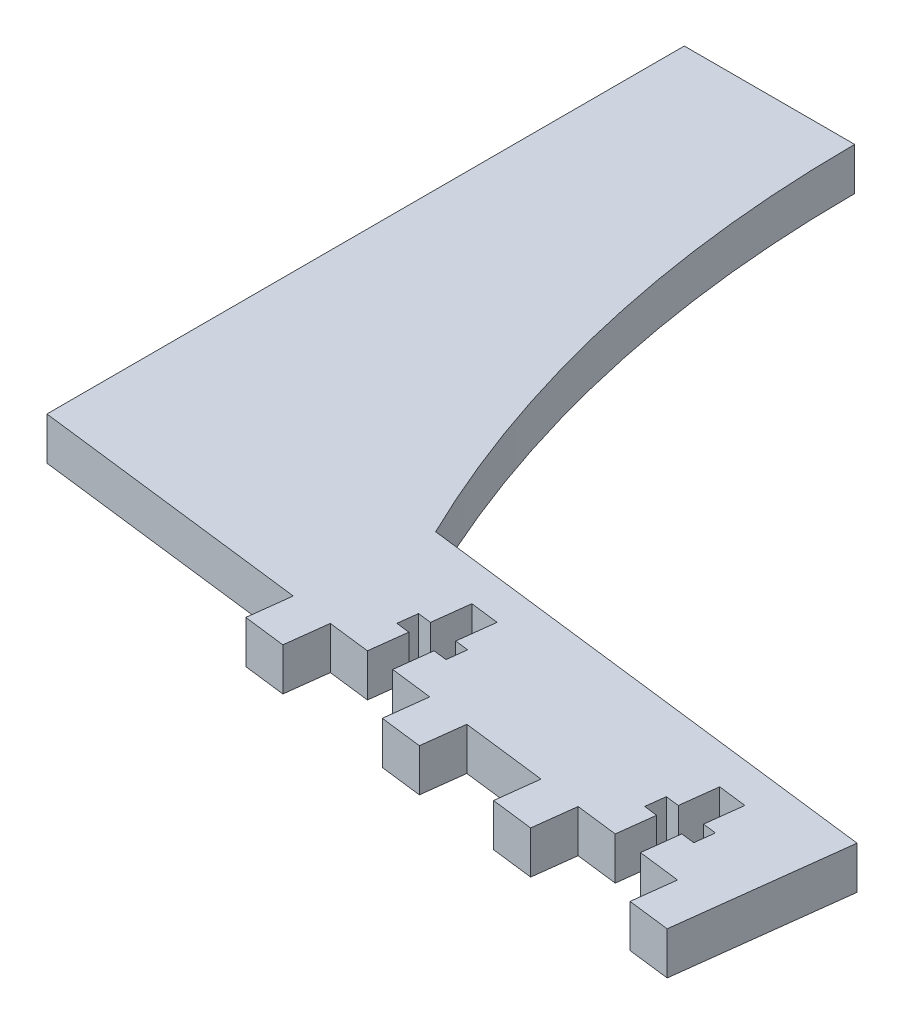
from build123d import *

# Parameters (mm, degrees)
BOSS_EXTRUDE1_DEPTH = 6.35


with BuildPart() as part:
    # Sketch1 → Boss-Extrude1 (new body)
    with BuildSketch(Plane(origin=(0, 0, 0), x_dir=(1, 0, 0), z_dir=(0, 1, 0))):
        with BuildLine():
            Line((71.346202472, -8.760212143), (83.951538598, -10.307952804))
            Line((83.951538598, -10.307952804), (83.177668268, -16.610620867))
            Line((83.177668268, -16.610620867), (89.48033633, -17.384491197))
            Line((89.48033633, -17.384491197), (90.254206661, -11.081823135))
            Line((90.254206661, -11.081823135), (96.556874724, -11.855693465))
            Line((96.556874724, -11.855693465), (97.231421537, -6.361950537))
            Line((97.231421537, -6.361950537), (95.20563486, -6.113215209))
            Line((95.20563486, -6.113215209), (95.559055961, -3.234831328))
            Line((95.559055961, -3.234831328), (97.584842638, -3.483566655))
            Line((97.584842638, -3.483566655), (98.259389451, 2.010176273))
            Line((98.259389451, 2.010176273), (102.545203734, 1.483944448))
            Line((102.545203734, 1.483944448), (101.870656921, -4.00979848))
            Line((101.870656921, -4.00979848), (103.896443599, -4.258533808))
            Line((103.896443599, -4.258533808), (103.543022498, -7.136917689))
            Line((103.543022498, -7.136917689), (101.51723582, -6.888182361))
            Line((101.51723582, -6.888182361), (100.842689007, -12.38192529))
            Line((100.842689007, -12.38192529), (107.14535707, -13.155795621))
            Line((107.14535707, -13.155795621), (106.371486739, -19.458463684))
            Line((106.371486739, -19.458463684), (112.674154802, -20.232334014))
            Line((112.674154802, -20.232334014), (113.448025133, -13.929665951))
            Line((113.448025133, -13.929665951), (115.769636124, 4.978338238))
            Line((115.769636124, 4.978338238), (44.17132693, 13.769505193))
            ThreePointArc((44.17132693, 13.769505193), (30.153869414, 53.312351607), (25.4, 94.996))
            Line((25.4, 94.996), (0, 94.996))
            Line((0, 94.996), (0, 0))
            Line((0, 0), (41.849715938, -5.138498995))
            Line((41.849715938, -5.138498995), (41.075845607, -11.441167058))
            Line((41.075845607, -11.441167058), (47.37851367, -12.215037389))
            Line((47.37851367, -12.215037389), (48.152384001, -5.912369326))
            Line((48.152384001, -5.912369326), (54.455052064, -6.686239657))
            Line((54.455052064, -6.686239657), (55.129598877, -1.192496728))
            Line((55.129598877, -1.192496728), (53.103812199, -0.9437614))
            Line((53.103812199, -0.9437614), (53.4572333, 1.934622481))
            Line((53.4572333, 1.934622481), (55.483019978, 1.685887153))
            Line((55.483019978, 1.685887153), (56.157566791, 7.179630082))
            Line((56.157566791, 7.179630082), (60.443381074, 6.653398257))
            Line((60.443381074, 6.653398257), (59.768834261, 1.159655329))
            Line((59.768834261, 1.159655329), (61.794620938, 0.910920001))
            Line((61.794620938, 0.910920001), (61.441199837, -1.967463881))
            Line((61.441199837, -1.967463881), (59.41541316, -1.718728553))
            Line((59.41541316, -1.718728553), (58.740866346, -7.212471481))
            Line((58.740866346, -7.212471481), (65.043534409, -7.986341812))
            Line((65.043534409, -7.986341812), (64.269664079, -14.289009875))
            Line((64.269664079, -14.289009875), (70.572332142, -15.062880206))
            Line((70.572332142, -15.062880206), (71.346202472, -8.760212143))
        make_face()
    extrude(amount=BOSS_EXTRUDE1_DEPTH)


solid = part.part
